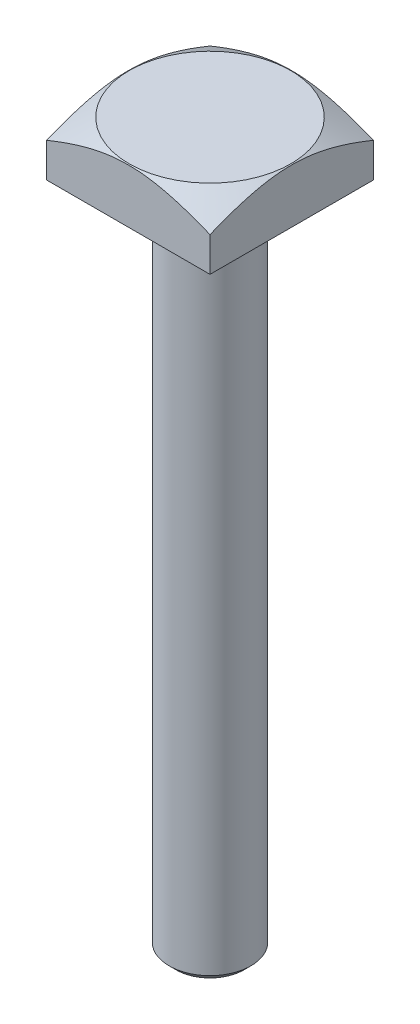
from build123d import *

# Parameters (mm, degrees)
SKETCH1_W           = 24
SKETCH1_H           = 24
BOSS_EXTRUDE1_DEPTH = 8
SKETCH2_OUTSIDE_W   = 60.688
SKETCH2_OUTSIDE_H   = 60.688
SKETCH2_OUTSIDE_R   = 11.874068454
CUT_EXTRUDE1_DEPTH  = 8
CUT_EXTRUDE1_DRAFT  = -60
SKETCH3_R           = 6
BOSS_EXTRUDE2_DEPTH = 98
CHAMFER1_SIZE       = 1


with BuildPart() as part:
    # Sketch1 → Boss-Extrude1 (new body)
    with BuildSketch(Plane(origin=(0, 0, 0), x_dir=(1, 0, 0), z_dir=(0, 1, 0))):
        Rectangle(SKETCH1_W, SKETCH1_H)
    extrude(amount=BOSS_EXTRUDE1_DEPTH)


with BuildPart() as cut_extrude1_tool:
    # Sketch2 outside → Cut-Extrude1 (with draft: the straight prism first)
    with BuildSketch(Plane(origin=(0, 8, 0), x_dir=(1, 0, 0), z_dir=(0, 1, 0))):
        Rectangle(SKETCH2_OUTSIDE_W, SKETCH2_OUTSIDE_H)
        Circle(SKETCH2_OUTSIDE_R, mode=Mode.SUBTRACT)
    extrude(amount=-CUT_EXTRUDE1_DEPTH)
    # Cut-Extrude1: the draft: its side faces are tilted about the plane it starts from
    cut_extrude1_sides = [cut_extrude1_tool.faces().sort_by_distance(p)[0] for p in [
        (0, 4, 30.344),
        (30.344, 4, 0),
        (0, 4, -30.344),
        (-30.344, 4, 0),
        (-11.874068454, 4, 0),
    ]]
    draft(cut_extrude1_sides, Plane(origin=(0, 8, 0), x_dir=(1, 0, 0), z_dir=(0, 1, 0)), CUT_EXTRUDE1_DRAFT)


with BuildPart() as part_1:
    add(part.part)

    # Cut-Extrude1: cut by cut_extrude1_tool
    add(cut_extrude1_tool.part, mode=Mode.SUBTRACT)

    # Sketch3 → Boss-Extrude2 (add)
    with BuildSketch(Plane.XZ):
        with Locations(Location((0, 0, 0), (0, 0, 270))):
            Circle(SKETCH3_R)
    extrude(amount=BOSS_EXTRUDE2_DEPTH)

    # Chamfer1
    chamfer1_edges = [part_1.edges().sort_by_distance(p)[0] for p in [
        (0, -98, 6),
    ]]
    chamfer(chamfer1_edges, length=CHAMFER1_SIZE)


solid = part_1.part
